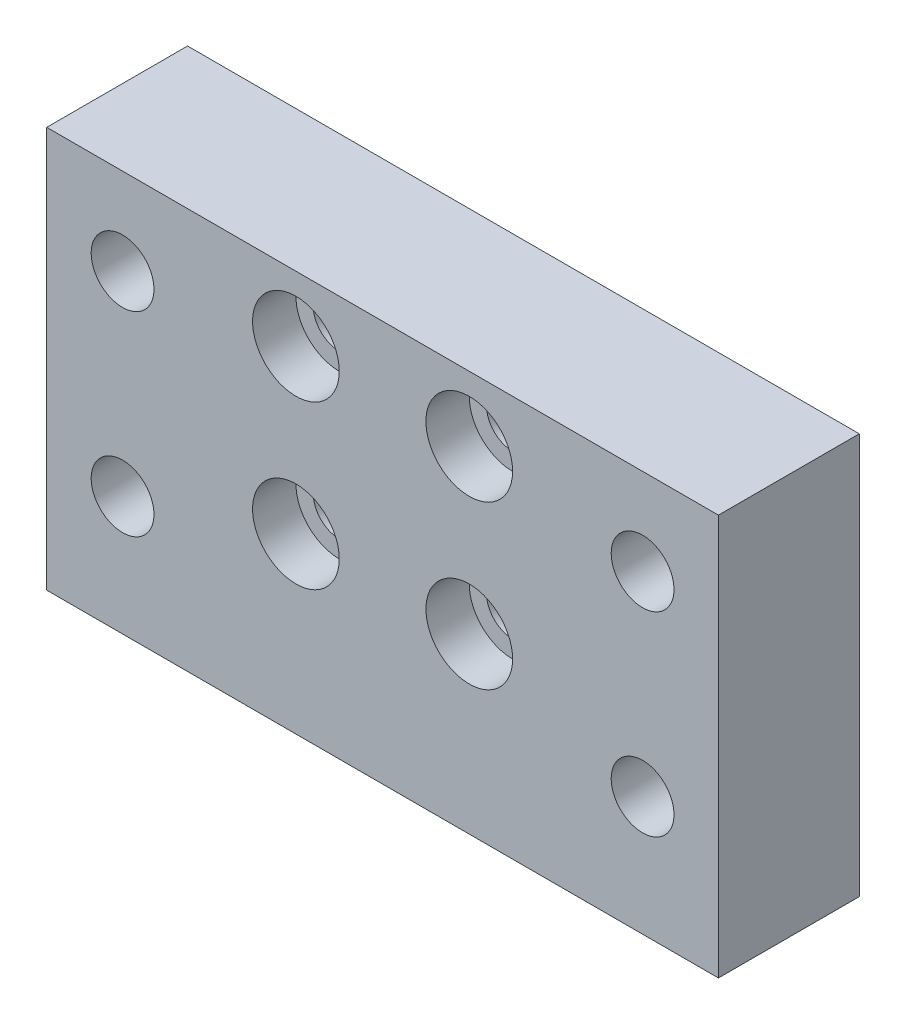
from build123d import *

# Parameters (mm, degrees)
SKETCH_1_W                   = 62
SKETCH_1_H                   = 37
EXTRUDE_1_DEPTH              = 13
HOLE_WIZARD_M5_1_D           = 5.8
HOLE_WIZARD_M5_1_CBORE_D     = 10
HOLE_WIZARD_M5_1_CBORE_DEPTH = 5
HOLE_WIZARD_M4_3_D           = 4.8
HOLE_WIZARD_M4_3_CBORE_D     = 8
HOLE_WIZARD_M4_3_CBORE_DEPTH = 4


with BuildPart() as part:
    # 草图1 → 凸台-拉伸1 (new body)
    with BuildSketch(Plane.XY):
        with Locations((31, 18.5)):
            Rectangle(SKETCH_1_W, SKETCH_1_H)
    extrude(amount=EXTRUDE_1_DEPTH)

    # M5 六角凹头螺钉的柱形沉头孔1 (through all)
    with Locations(Plane(origin=(0, 0, 0), x_dir=(-1, 0, 0), z_dir=(0, 0, -1))):
        with Locations((-7, 11), (-7, 29), (-55, 11), (-55, 29)):
            CounterBoreHole(HOLE_WIZARD_M5_1_D / 2, HOLE_WIZARD_M5_1_CBORE_D / 2, HOLE_WIZARD_M5_1_CBORE_DEPTH)

    # M4 六角凹头螺钉的柱形沉头孔3 (through all)
    with Locations(Plane.XY.offset(13)):
        with Locations((39, 16), (23, 16), (23, 31), (39, 31)):
            CounterBoreHole(HOLE_WIZARD_M4_3_D / 2, HOLE_WIZARD_M4_3_CBORE_D / 2, HOLE_WIZARD_M4_3_CBORE_DEPTH)


solid = part.part
